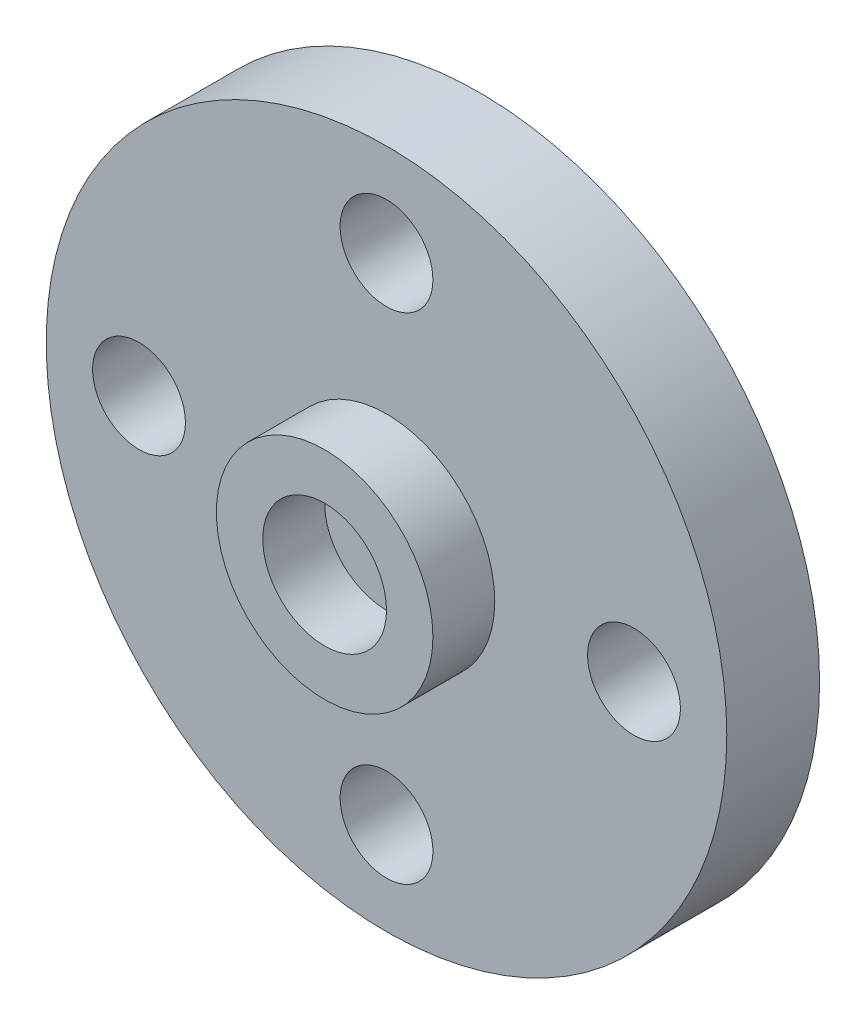
from build123d import *

# Parameters (mm, degrees)
SKETCH1_R           = 11
BOSS_EXTRUDE1_DEPTH = 3
SKETCH2_R           = 1.5
CUT_EXTRUDE1_DEPTH  = 3
SKETCH3_R           = 3.5
SKETCH3_R_2         = 2
BOSS_EXTRUDE2_DEPTH = 2


with BuildPart() as part:
    # Sketch1 → Boss-Extrude1 (new body)
    with BuildSketch(Plane.XY):
        Circle(SKETCH1_R)
    extrude(amount=BOSS_EXTRUDE1_DEPTH)

    # Sketch2 → Cut-Extrude1 (cut)
    with BuildSketch(Plane.XY.offset(3)):
        with Locations((0, 8)):
            Circle(SKETCH2_R)
        with Locations((-8, 0)):
            Circle(SKETCH2_R)
        with Locations(Location((0, -8, 0), (0, 0, 180))):
            Circle(SKETCH2_R)
        with Locations(Location((8, 0, 0), (0, 0, 180))):
            Circle(SKETCH2_R)
    extrude(amount=-CUT_EXTRUDE1_DEPTH, mode=Mode.SUBTRACT)

    # Sketch3 → Boss-Extrude2 (add)
    with BuildSketch(Plane.XY.offset(3)):
        Circle(SKETCH3_R)
        Circle(SKETCH3_R_2, mode=Mode.SUBTRACT)
    extrude(amount=BOSS_EXTRUDE2_DEPTH)


solid = part.part
